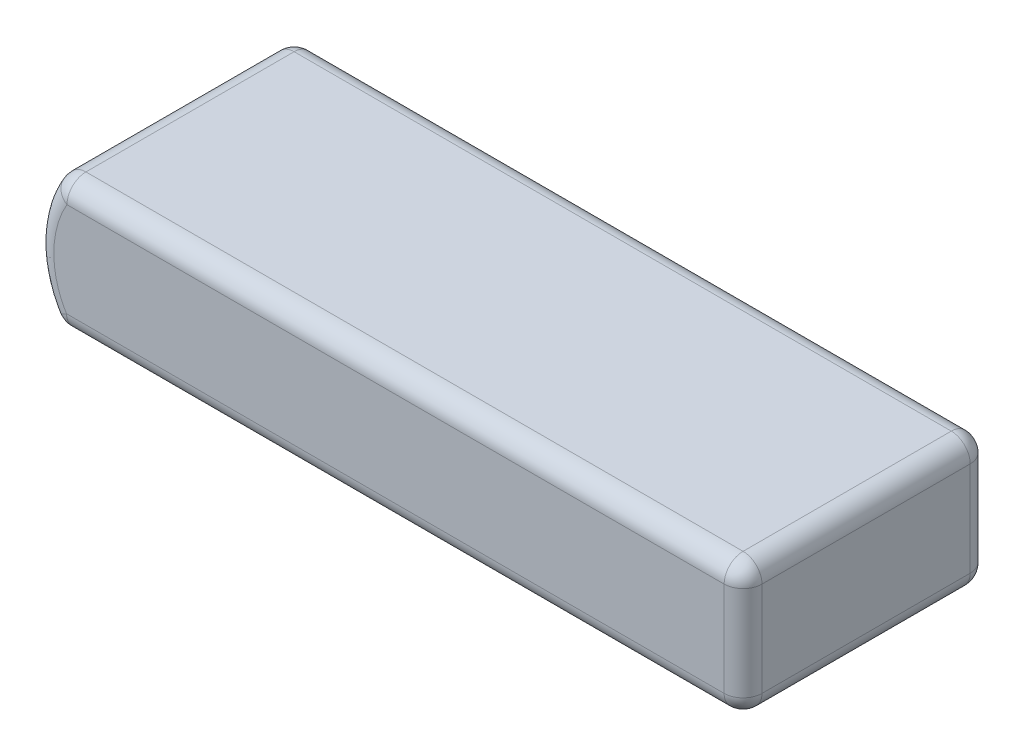
from build123d import *

# Parameters (mm, degrees)
SKETCH1_W           = 145
SKETCH1_H           = 52
BOSS_EXTRUDE1_DEPTH = 28
BOSS_EXTRUDE2_DEPTH = 52
FILLET1_R           = 4


with BuildPart() as part:
    # Sketch1 → Boss-Extrude1 (new body)
    with BuildSketch(Plane(origin=(0, 0, 0), x_dir=(1, 0, 0), z_dir=(0, 1, 0))):
        Rectangle(SKETCH1_W, SKETCH1_H)
    extrude(amount=BOSS_EXTRUDE1_DEPTH)

    # Sketch2 → Boss-Extrude2 (add)
    with BuildSketch(Plane.XY.offset(26)):
        with BuildLine():
            Line((-72.5, 28), (-72.5, 0))
            add(Edge.make_bspline(
                [(-72.5, 28), (-78.493180673, 20.025672692), (-78.910368837, 7.889631717), (-72.5, 0)],
                knots=[0, 0, 0, 0, 1, 1, 1, 1], degree=3))
        make_face()
    extrude(amount=-BOSS_EXTRUDE2_DEPTH)

    # Fillet1
    fillet1_edges = [part.edges().sort_by_distance(p)[0] for p in [
        (-72.5, 28, 0),
        (0, 28, 26),
        (-77.151285846, 13.972552869, -26),
        (-77.151285846, 13.972552869, 26),
        (72.5, 28, 0),
        (0, 0, 26),
        (-72.5, 0, 0),
        (0, 0, -26),
        (72.5, 0, 0),
        (0, 28, -26),
        (72.5, 14, 26),
        (72.5, 14, -26),
    ]]
    fillet(fillet1_edges, radius=FILLET1_R)


solid = part.part
